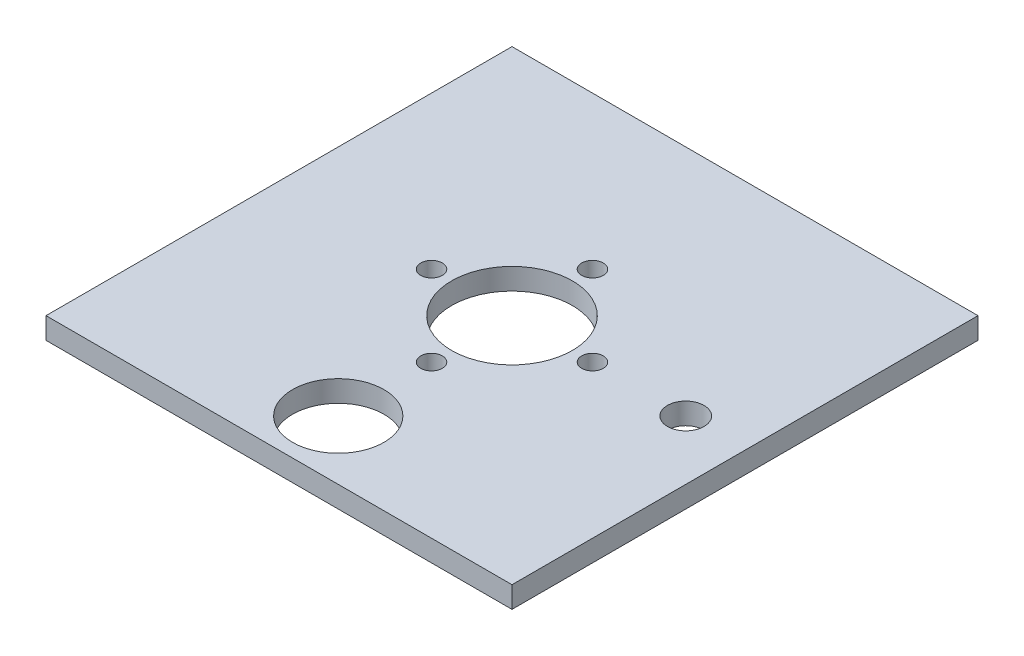
from build123d import *

# Parameters (mm, degrees)
SKETCH1_W           = 64.7192
SKETCH1_H           = 64.7192
SKETCH1_R           = 2.54
SKETCH1_R_2         = 6.35
SKETCH1_R_3         = 8.382
SKETCH1_R_4         = 1.5
BOSS_EXTRUDE1_DEPTH = 2.9718


with BuildPart() as part:
    # Sketch1 → Boss-Extrude1 (new body)
    with BuildSketch(Plane(origin=(0, 0, 0), x_dir=(1, 0, 0), z_dir=(0, 1, 0))):
        Rectangle(SKETCH1_W, SKETCH1_H)
        with Locations(Location((24.13, 0, 0), (0, 0, 270))):
            Circle(SKETCH1_R, mode=Mode.SUBTRACT)
        with Locations(Location((0, -24.13, 0), (0, 0, 270))):
            Circle(SKETCH1_R_2, mode=Mode.SUBTRACT)
        with Locations(Location((0, 0, 0), (0, 0, 270))):
            Circle(SKETCH1_R_3, mode=Mode.SUBTRACT)
        with Locations(Location((0, 11.176, 0), (0, 0, 270))):
            Circle(SKETCH1_R_4, mode=Mode.SUBTRACT)
        with Locations(Location((11.176, 0, 0), (0, 0, 270))):
            Circle(SKETCH1_R_4, mode=Mode.SUBTRACT)
        with Locations(Location((0, -11.176, 0), (0, 0, 270))):
            Circle(SKETCH1_R_4, mode=Mode.SUBTRACT)
        with Locations(Location((-11.176, 0, 0), (0, 0, 270))):
            Circle(SKETCH1_R_4, mode=Mode.SUBTRACT)
    extrude(amount=BOSS_EXTRUDE1_DEPTH)


solid = part.part
